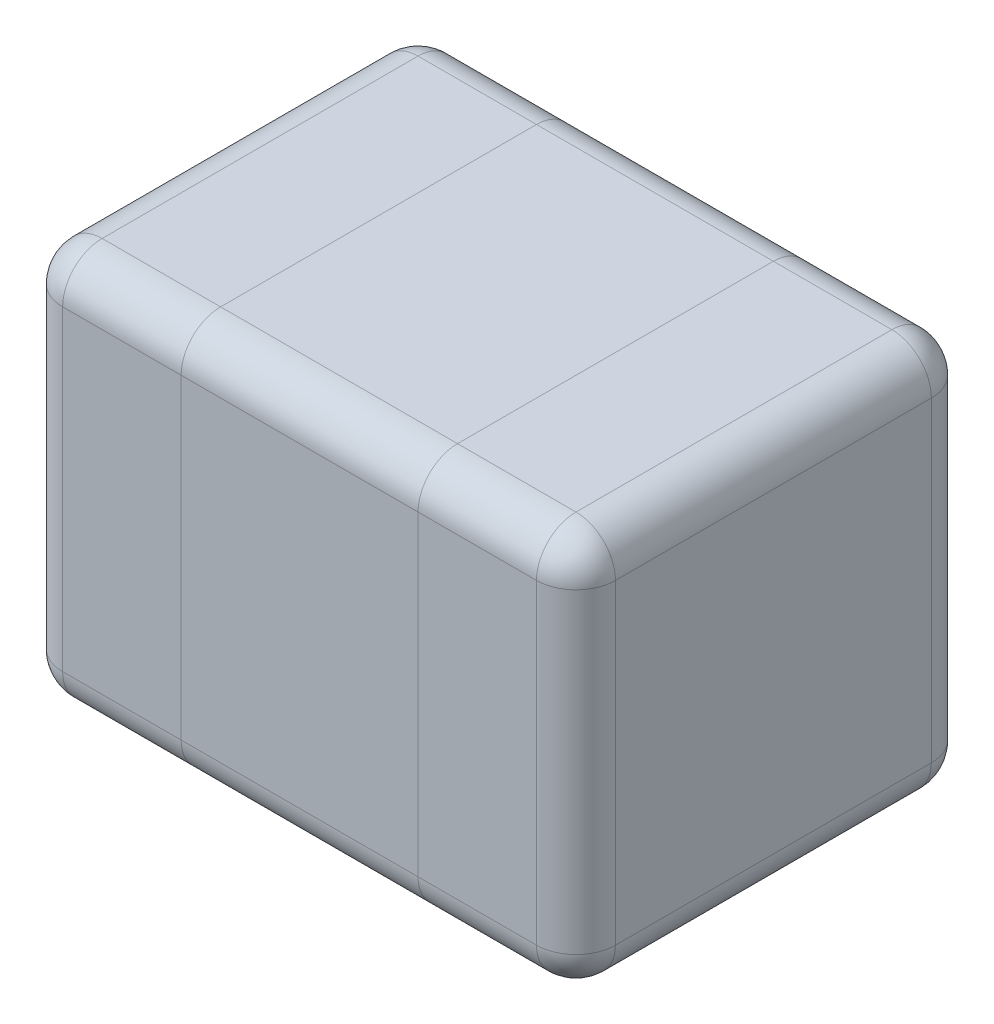
from build123d import *

# Parameters (mm, degrees)
CROQUIS1_W                = 0.3
CROQUIS1_H                = 0.5
SALIENTE_EXTRUIR1_DEPTH   = 0.5
CROQUIS3_W                = 0.2
CROQUIS3_H                = 0.5
SALIENTE_EXTRUIR3_DEPTH   = 0.5
SALIENTE_EXTRUIR3_2_DEPTH = 0.5
REDONDEO2_R               = 0.05
REDONDEO4_R               = 0.05
REDONDEO5_R               = 0.05


with BuildPart() as part:
    # Croquis1 → Saliente-Extruir1 (new body)
    with BuildSketch(Plane(origin=(0, 0, 0), x_dir=(1, 0, 0), z_dir=(0, 1, 0))):
        Rectangle(CROQUIS1_W, CROQUIS1_H)
    extrude(amount=SALIENTE_EXTRUIR1_DEPTH)

    # Redondeo2
    redondeo2_edges = [part.edges().sort_by_distance(p)[0] for p in [
        (0, 0.5, 0.25),
        (0, 0, 0.25),
        (0, 0, -0.25),
        (0, 0.5, -0.25),
    ]]
    fillet(redondeo2_edges, radius=REDONDEO2_R)


with BuildPart() as body_2:
    # Croquis3 → Saliente-Extruir3 (new body)
    with BuildSketch(Plane(origin=(0, 0, 0), x_dir=(1, 0, 0), z_dir=(0, 1, 0))):
        with Locations((0.25, 0)):
            Rectangle(CROQUIS3_W, CROQUIS3_H)
    extrude(amount=SALIENTE_EXTRUIR3_DEPTH)

    # Redondeo4
    redondeo4_edges = [body_2.edges().sort_by_distance(p)[0] for p in [
        (0.35, 0.5, 0),
        (0.25, 0.5, -0.25),
        (0.25, 0, -0.25),
        (0.35, 0, 0),
        (0.25, 0, 0.25),
        (0.35, 0.25, -0.25),
        (0.35, 0.25, 0.25),
        (0.25, 0.5, 0.25),
    ]]
    fillet(redondeo4_edges, radius=REDONDEO4_R)


with BuildPart() as body_3:
    # Croquis3 → Saliente-Extruir3 2 (new body)
    with BuildSketch(Plane(origin=(0, 0, 0), x_dir=(1, 0, 0), z_dir=(0, 1, 0))):
        with Locations((-0.25, 0)):
            Rectangle(CROQUIS3_W, CROQUIS3_H)
    extrude(amount=SALIENTE_EXTRUIR3_2_DEPTH)

    # Redondeo5
    redondeo5_edges = [body_3.edges().sort_by_distance(p)[0] for p in [
        (-0.25, 0.5, -0.25),
        (-0.35, 0.5, 0),
        (-0.25, 0.5, 0.25),
        (-0.35, 0, 0),
        (-0.25, 0, -0.25),
        (-0.25, 0, 0.25),
        (-0.35, 0.25, 0.25),
        (-0.35, 0.25, -0.25),
    ]]
    fillet(redondeo5_edges, radius=REDONDEO5_R)


solid = Compound([part.part, body_2.part, body_3.part])
